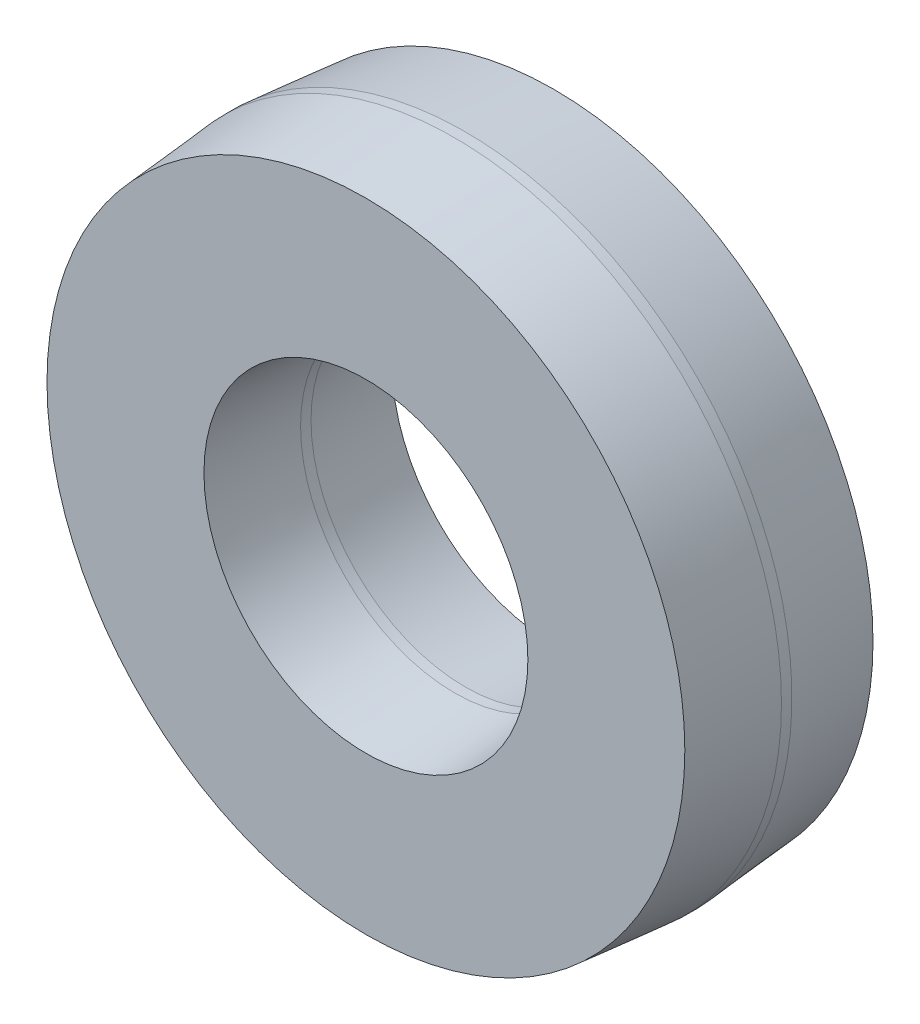
from build123d import *

# Parameters (mm, degrees)
SKETCH_1_R      = 62.5
SKETCH_1_R_2    = 29.5
EXTRUDE_1_DEPTH = 17
EXTRUDE_1_DRAFT = 5
SKETCH_2_R      = 62.5
SKETCH_2_R_2    = 29.5
EXTRUDE_2_DEPTH = 2
SKETCH_3_R      = 62.5
SKETCH_3_R_2    = 29.5
EXTRUDE_3_DEPTH = 17
EXTRUDE_3_DRAFT = 5


with BuildPart() as part:
    # Эскиз1 → Вытянуть1 (with draft: the straight prism first)
    with BuildSketch(Plane.XY):
        Circle(SKETCH_1_R)
        Circle(SKETCH_1_R_2, mode=Mode.SUBTRACT)
    extrude(amount=EXTRUDE_1_DEPTH)
    # Вытянуть1: the draft: its side faces are tilted about the plane it starts from
    extrude_1_sides = [part.faces().sort_by_distance(p)[0] for p in [
        (-62.5, 0, 8.5),
        (-29.5, 0, 8.5),
    ]]
    draft(extrude_1_sides, Plane.XY, EXTRUDE_1_DRAFT)

    # Эскиз2 → Вытянуть2 (add)
    with BuildSketch(Plane(origin=(0, 0, 0), x_dir=(-1, 0, 0), z_dir=(0, 0, -1))):
        Circle(SKETCH_2_R)
        with Locations(Location((0, 0, 0), (0, 0, 180))):
            Circle(SKETCH_2_R_2, mode=Mode.SUBTRACT)
    extrude(amount=EXTRUDE_2_DEPTH)


with BuildPart() as extrude_3_tool:
    # Эскиз3 → Вытянуть3 (with draft: the straight prism first)
    with BuildSketch(Plane(origin=(0, 0, -2), x_dir=(-1, 0, 0), z_dir=(0, 0, -1))):
        Circle(SKETCH_3_R)
        with Locations(Location((0, 0, 0), (0, 0, 180))):
            Circle(SKETCH_3_R_2, mode=Mode.SUBTRACT)
    extrude(amount=EXTRUDE_3_DEPTH)
    # Вытянуть3: the draft: its side faces are tilted about the plane it starts from
    extrude_3_sides = [extrude_3_tool.faces().sort_by_distance(p)[0] for p in [
        (62.5, 0, -10.5),
        (-29.5, 0, -10.5),
    ]]
    draft(extrude_3_sides, Plane(origin=(0, 0, -2), x_dir=(-1, 0, 0), z_dir=(0, 0, -1)), EXTRUDE_3_DRAFT)


with BuildPart() as part_1:
    add(part.part)

    # Вытянуть3: add extrude_3_tool
    add(extrude_3_tool.part)


solid = part_1.part
